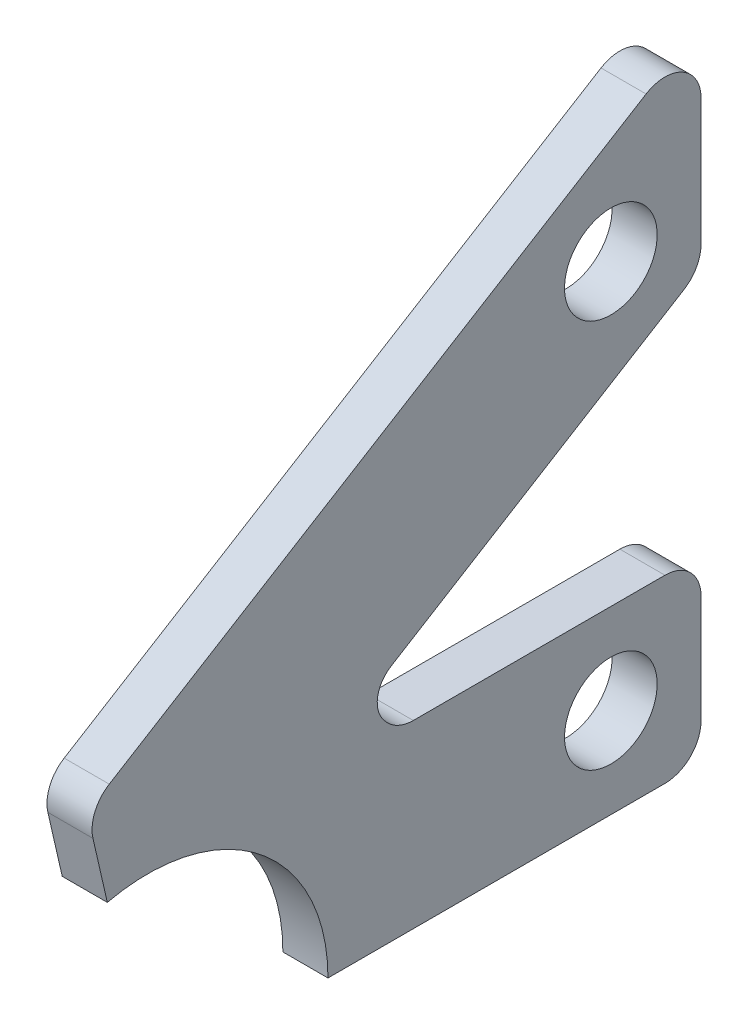
from build123d import *

# Parameters (mm, degrees)
SKETCH2_R           = 3.2639
BOSS_EXTRUDE1_DEPTH = 3.175


with BuildPart() as part:
    # Sketch2 → Boss-Extrude1 (new body)
    with BuildSketch(Plane(origin=(-112.555, 0, -573.58969557), x_dir=(0, 0.6231241879767124, 0.7821229100073485), z_dir=(-1, 0, 0))):
        with BuildLine():
            ThreePointArc((845.36792337, 140.568969032), (844.830619791, 138.700663745), (845.771780124, 136.999641403))
            Line((845.771780124, 136.999641403), (864.330586832, 122.213677187))
            ThreePointArc((864.330586832, 122.213677187), (874.263547789, 127), (884.196508746, 122.213677187))
            Line((884.196508746, 122.213677187), (887.735832346, 125.033487368))
            ThreePointArc((887.735832346, 125.033487368), (888.597587529, 126.330104481), (888.540958266, 127.885942216))
            Line((888.540958266, 127.885942216), (873.423706379, 169.576043207))
            ThreePointArc((873.423706379, 169.576043207), (871.446613669, 171.216745754), (869.04925283, 170.292915988))
            Line((869.04925283, 170.292915988), (863.47898249, 163.301314423))
            ThreePointArc((863.47898249, 163.301314423), (862.959009478, 162.129347633), (863.077713324, 160.852716328))
            Line((863.077713324, 160.852716328), (871.323924882, 138.111453883))
            ThreePointArc((871.323924882, 138.111453883), (871.188959814, 136.430204891), (869.830832527, 135.430052896))
            ThreePointArc((869.830832527, 135.430052896), (869.749583246, 135.412845003), (869.668400761, 135.39532469))
            ThreePointArc((869.668400761, 135.39532469), (868.550892206, 135.403510223), (867.545059791, 135.890535404))
            Line((867.545059791, 135.890535404), (853.685457311, 146.932602361))
            ThreePointArc((853.685457311, 146.932602361), (851.817152024, 147.46990594), (850.116129682, 146.528745607))
            Line((850.116129682, 146.528745607), (845.36792337, 140.568969032))
        make_face()
        with Locations((852.708507005, 139.592018726)):
            Circle(SKETCH2_R, mode=Mode.SUBTRACT)
        with Locations((869.774365973, 161.012466745)):
            Circle(SKETCH2_R, mode=Mode.SUBTRACT)
    extrude(amount=BOSS_EXTRUDE1_DEPTH)


solid = part.part
